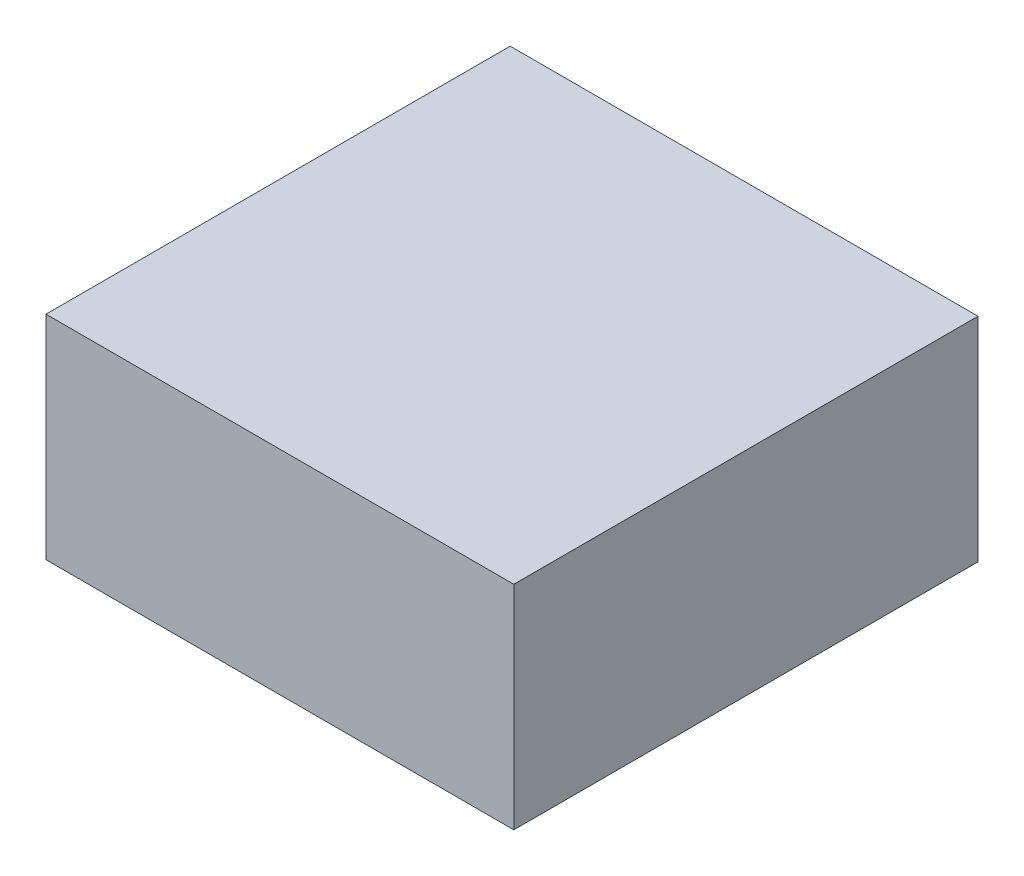
from build123d import *

# Parameters (mm, degrees)
SKETCH1_W              = 11000
SKETCH1_H              = 10900
PISO_DEPTH             = 200
SKETCH2_W              = 11000
SKETCH2_H              = 10900
SKETCH2_W_2            = 10600
SKETCH2_H_2            = 10500
PAREDES_DEPTH          = 3000
SKETCH7_W              = 10600
SKETCH7_H              = 10500
SKETCH7_W_2            = 10480
SKETCH7_H_2            = 10380
AISLANTE_PAREDES_DEPTH = 3000
SKETCH27_W             = 10480
SKETCH27_H             = 10380
AISLANTE_SUELO_DEPTH   = 100
L_MINA_TRASERA_DEPTH   = 10
L_MINA_EXTERIOR_DEPTH  = 5450
BOSS_EXTRUDE24_DEPTH   = 100
BOSS_EXTRUDE34_DEPTH   = 10680
BOSS_EXTRUDE35_REACH   = 13070.542
BOSS_EXTRUDE36_REACH   = 12946.971
SKETCH45_W             = 10480
SKETCH45_H             = 2900
EXTERIOR_P1_DEPTH      = 10900
SKETCH50_W             = 13000
SKETCH50_H             = 5910.466791247
EXTERIOR_P2_DEPTH      = 1000


with BuildPart() as part:
    # Sketch1 → Piso (new body)
    with BuildSketch(Plane(origin=(0, 0, 0), x_dir=(1, 0, 0), z_dir=(0, 1, 0))):
        Rectangle(SKETCH1_W, SKETCH1_H)
    extrude(amount=PISO_DEPTH)


with BuildPart() as body_2:
    # Sketch2 → Paredes (new body)
    with BuildSketch(Plane(origin=(0, 200, 0), x_dir=(1, 0, 0), z_dir=(0, 1, 0))):
        Rectangle(SKETCH2_W, SKETCH2_H)
        Rectangle(SKETCH2_W_2, SKETCH2_H_2, mode=Mode.SUBTRACT)
    extrude(amount=PAREDES_DEPTH)


with BuildPart() as body_3:
    # Sketch7 → Aislante Paredes (new body)
    with BuildSketch(Plane(origin=(0, 200, 0), x_dir=(1, 0, 0), z_dir=(0, 1, 0))):
        Rectangle(SKETCH7_W, SKETCH7_H)
        Rectangle(SKETCH7_W_2, SKETCH7_H_2, mode=Mode.SUBTRACT)
    extrude(amount=AISLANTE_PAREDES_DEPTH)


with BuildPart() as body_4:
    # Sketch27 → Aislante suelo (new body)
    with BuildSketch(Plane(origin=(0, 200, 0), x_dir=(1, 0, 0), z_dir=(0, 1, 0))):
        Rectangle(SKETCH27_W, SKETCH27_H)
    extrude(amount=AISLANTE_SUELO_DEPTH)

    # Piso&aislante: union part
    add(part.part)


with BuildPart() as body_5:
    # Sketch20 → Lámina Trasera (new body)
    with BuildSketch(Plane(origin=(0, 0, -5450), x_dir=(1, 0, 0), z_dir=(0, 0, -1))):
        Polygon((0, -4900), (5500, -3200), (-5500, -3200), align=None)
    extrude(amount=-L_MINA_TRASERA_DEPTH)


with BuildPart() as body_6:
    # Lámina Frontal: mirrored copy
    add(body_5.part.mirror(Plane.XY))


with BuildPart() as body_7:
    # Sketch48 → Lámina Exterior (new, symmetric)
    with BuildSketch(Plane.XY):
        Polygon((-5500, 3200), (-5500, 3210.466791247), (0, 4910.466791247), (5500, 3210.466791247), (5500, 3200), (0, 4900), align=None)
    extrude(amount=L_MINA_EXTERIOR_DEPTH, both=True)


with BuildPart() as body_8:
    # Sketch35 → Boss-Extrude24 (new body)
    with BuildSketch(Plane.XY.offset(-5440)):
        Polygon((-5500, 3200), (0, 4900), (5500, 3200), align=None)
    extrude(amount=BOSS_EXTRUDE24_DEPTH)


with BuildPart() as body_9:
    # Mirror3: mirrored copy
    add(body_8.part.mirror(Plane.XY))


with BuildPart() as body_10:
    # Sketch43 → Boss-Extrude34 (new body)
    with BuildSketch(Plane(origin=(0, 0, 5340), x_dir=(-1, 0, 0), z_dir=(0, 0, -1))):
        Polygon((0, 4900), (0, 4795.33208753), (-5161.368518479, 3200), (-5500, 3200), align=None)
    extrude(amount=BOSS_EXTRUDE34_DEPTH)


with BuildPart() as body_11:
    # Mirror8: mirrored copy
    add(body_10.part.mirror(Plane(origin=(0, 0, 0), x_dir=(0, 0, 1), z_dir=(1, 0, 0))))

    # Combine_Aislante: union body 10, body 8, body 9
    add(body_10.part)
    add(body_8.part)
    add(body_9.part)


with BuildPart() as body_5_1:
    add(body_5.part)

    # Combine_Laminas: union body 6, body 7
    add(body_6.part)
    add(body_7.part)


with BuildPart() as body_7_2:

    # Sketch44 → Boss-Extrude35 (new, up to next)
    with BuildSketch(Plane(origin=(0, 0, 5340), x_dir=(-1, 0, 0), z_dir=(0, 0, -1)), mode=Mode.PRIVATE) as boss_extrude35_sk1:
        Polygon((-5161.368518479, 3200), (0, 4795.33208753), (5161.368518479, 3200), align=None)
    boss_extrude35_tool1 = extrude(boss_extrude35_sk1.sketch, amount=BOSS_EXTRUDE35_REACH, mode=Mode.PRIVATE) - body_11.part
    add(boss_extrude35_tool1.solids().sort_by_distance((0, 3731.777363, 5340))[0])


    # Sketch45 → Boss-Extrude36 (add, up to next)
    with BuildSketch(Plane(origin=(0, 0, 5190), x_dir=(-1, 0, 0), z_dir=(0, 0, -1)), mode=Mode.PRIVATE) as boss_extrude36_sk1:
        with Locations((0, 1750)):
            Rectangle(SKETCH45_W, SKETCH45_H)
    boss_extrude36_tool1 = extrude(boss_extrude36_sk1.sketch, amount=BOSS_EXTRUDE36_REACH, mode=Mode.PRIVATE) - body_3.part
    add(boss_extrude36_tool1.solids().sort_by_distance((0, 1750, 5190))[0])


with BuildPart() as body_6_2:
    # Sketch49 → Exterior_p1 (new body)
    with BuildSketch(Plane.XY.offset(5450)):
        Polygon((-5500, 0), (-6500, 0), (-6500, 5910.466791247), (6500, 5910.466791247), (6500, 0), (5500, 0), (5500, 3210.466791247), (0, 4910.466791247), (-5500, 3210.466791247), align=None)
    extrude(amount=-EXTERIOR_P1_DEPTH)


with BuildPart() as body_7_3:
    # Sketch50 → Exterior_p2 (new body)
    with BuildSketch(Plane.XY.offset(5450)):
        with Locations((0, 2955.233395624)):
            Rectangle(SKETCH50_W, SKETCH50_H)
    extrude(amount=EXTERIOR_P2_DEPTH)


with BuildPart() as body_8_2:
    # Mirror10: mirrored copy
    add(body_7_3.part.mirror(Plane.XY))


with BuildPart() as body_7_3_1:
    add(body_7_3.part)

    # Exterior: union body 6 2, body 8 2
    add(body_6_2.part)
    add(body_8_2.part)


solid = Compound([body_2.part, body_3.part, body_4.part, body_11.part, body_5_1.part, body_7_3_1.part])
